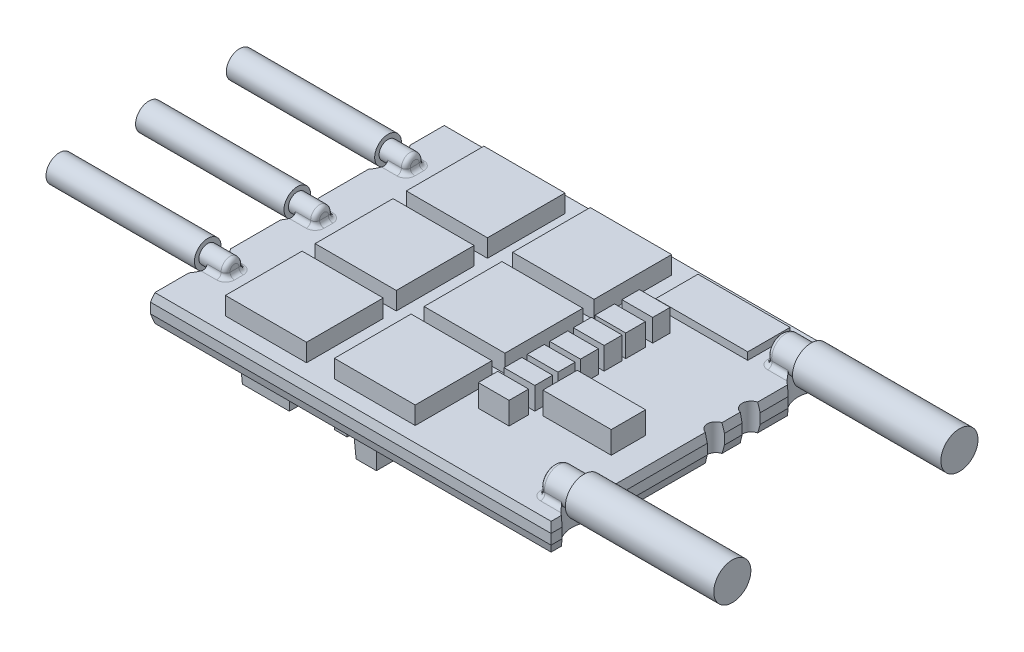
from build123d import *

# Parameters (mm, degrees)
ESQUISSE1_W                  = 27
ESQUISSE1_H                  = 19.8
BOSS_EXTRU_1_DEPTH           = 1.8
CHANFREIN1_SIZE              = 0.15
CHANFREIN1_SIZE2             = 0.559807621
CHANFREIN2_SIZE              = 0.15
CHANFREIN2_SIZE2             = 0.559807621
ESQUISSE2_R                  = 2.334528947
ESQUISSE2_R_2                = 2.262823971
ESQUISSE2_R_3                = 1.776828947
ESQUISSE2_R_4                = 0.577555873
ESQUISSE2_R_5                = 0.603985222
ENL_V_MAT_EXTRU_1_DEPTH      = 1.8
ESQUISSE3_W                  = 5.467187449
ESQUISSE3_H                  = 5.227748583
ESQUISSE3_H_2                = 5.247701822
ESQUISSE3_H_3                = 5.167888865
ESQUISSE3_W_2                = 5.487140688
ESQUISSE3_W_3                = 5.44723421
BOSS_EXTRU_2_DEPTH           = 1.2
ESQUISSE4_W                  = 2.075136842
ESQUISSE4_H                  = 1.177241093
ESQUISSE4_H_2                = 1.316913765
ESQUISSE4_H_3                = 1.21714757
ESQUISSE4_H_4                = 1.217147571
ESQUISSE4_H_5                = 1.157287854
ESQUISSE4_H_6                = 1.197194332
ESQUISSE4_W_2                = 4.609198178
ESQUISSE4_H_7                = 2.314575709
BOSS_EXTRU_3_DEPTH           = 1.5
ESQUISSE5_W                  = 6.205457286
ESQUISSE5_H                  = 2.853313158
BOSS_EXTRU_4_DEPTH           = 0.5
ESQUISSE7_W                  = 3.352144129
ESQUISSE7_H                  = 4.808730566
BOSS_EXTRU_5_DEPTH           = 1.8
BOSS_EXTRU_5_DRAFT           = 3
ESQUISSE7_H_2                = 5.008262955
BOSS_EXTRU_5_PROFILE_2_DEPTH = 1.8
BOSS_EXTRU_5_PROFILE_2_DRAFT = 3
ESQUISSE7_H_3                = 4.848637044
BOSS_EXTRU_5_PROFILE_3_DEPTH = 1.8
BOSS_EXTRU_5_PROFILE_3_DRAFT = 3
ESQUISSE7_W_2                = 6.644428542
ESQUISSE7_H_4                = 6.804054453
BOSS_EXTRU_5_PROFILE_4_DEPTH = 1.8
BOSS_EXTRU_5_PROFILE_4_DRAFT = 3
ESQUISSE7_W_3                = 1.556352632
ESQUISSE7_H_5                = 2.943102732
BOSS_EXTRU_5_PROFILE_5_DEPTH = 1.8
BOSS_EXTRU_5_PROFILE_5_DRAFT = 3
ESQUISSE7_W_4                = 0.857989271
ESQUISSE7_H_6                = 3.012939069
BOSS_EXTRU_5_PROFILE_6_DEPTH = 1.8
BOSS_EXTRU_5_PROFILE_6_DRAFT = 3
ESQUISSE7_W_5                = 1.037568421
ESQUISSE7_H_7                = 1.316913765
BOSS_EXTRU_5_PROFILE_7_DEPTH = 1.8
BOSS_EXTRU_5_PROFILE_7_DRAFT = 3
ESQUISSE8_R                  = 0.9
BOSS_EXTRU_6_DEPTH           = 10
BOSS_EXTRU_6_2_DEPTH         = 10
BOSS_EXTRU_6_3_DEPTH         = 10
ESQUISSE9_R                  = 0.6
BOSS_EXTRU_7_DEPTH           = 1.8
CONG_1_R                     = 0.3
ESQUISSE10_R                 = 1.25
BOSS_EXTRU_8_DEPTH           = 10
BOSS_EXTRU_8_2_DEPTH         = 10
ESQUISSE11_R                 = 0.95
BOSS_EXTRU_9_DEPTH           = 2
CONG_2_R                     = 0.3


with BuildPart() as part:
    # Esquisse1 → Boss.-Extru.1 (new body)
    with BuildSketch(Plane(origin=(0, 0, 0), x_dir=(1, 0, 0), z_dir=(0, 1, 0))):
        Rectangle(ESQUISSE1_W, ESQUISSE1_H)
    extrude(amount=BOSS_EXTRU_1_DEPTH)

    # Chanfrein1
    chanfrein1_edges = [part.edges().sort_by_distance(p)[0] for p in [
        (13.5, 1.8, 0),
        (0, 1.8, -9.9),
        (-13.5, 1.8, 0),
        (0, 1.8, 9.9),
    ]]
    chanfrein1_side = [part.faces().sort_by_distance(p)[0] for p in [
        (0, 1.8, 0),
    ]]
    chamfer(chanfrein1_edges, length=CHANFREIN1_SIZE, length2=CHANFREIN1_SIZE2, reference=chanfrein1_side[0])

    # Chanfrein2
    chanfrein2_edges = [part.edges().sort_by_distance(p)[0] for p in [
        (0, 0, -9.9),
        (13.5, 0, 0),
        (0, 0, 9.9),
        (-13.5, 0, 0),
    ]]
    chanfrein2_side = [part.faces().sort_by_distance(p)[0] for p in [
        (0, 0, 0),
    ]]
    chamfer(chanfrein2_edges, length=CHANFREIN2_SIZE, length2=CHANFREIN2_SIZE2, reference=chanfrein2_side[0])

    # Esquisse2 → Enlèv. mat.-Extru.1 (cut)
    with BuildSketch(Plane(origin=(0, 1.8, 0), x_dir=(1, 0, 0), z_dir=(0, 1, 0))):
        with Locations((-15.214344634, 6.045831376)):
            Circle(ESQUISSE2_R)
        with Locations((-15.220676016, 0)):
            Circle(ESQUISSE2_R_2)
        with Locations((-15.214344634, -6.045831376)):
            Circle(ESQUISSE2_R)
        with Locations((14.39092333, 7.616919158)):
            Circle(ESQUISSE2_R_3)
        with Locations((14.39092333, -7.616919158)):
            Circle(ESQUISSE2_R_3)
        with Locations((13.5, 1.202671446)):
            Circle(ESQUISSE2_R_4)
        with Locations((13.5, 3.581288306)):
            Circle(ESQUISSE2_R_5)
    extrude(amount=-ENL_V_MAT_EXTRU_1_DEPTH, mode=Mode.SUBTRACT)

    # Esquisse3 → Boss.-Extru.2 (add)
    with BuildSketch(Plane(origin=(0, 1.8, 0), x_dir=(1, 0, 0), z_dir=(0, 1, 0))):
        with Locations((-6.873890789, 6.065784615)):
            Rectangle(ESQUISSE3_W, ESQUISSE3_H)
        with Locations((-6.873890789, -0.069836336)):
            Rectangle(ESQUISSE3_W, ESQUISSE3_H_2)
        with Locations((-6.873890789, -6.15557419)):
            Rectangle(ESQUISSE3_W, ESQUISSE3_H_3)
        with Locations((0.299298583, 6.065784615)):
            Rectangle(ESQUISSE3_W_2, ESQUISSE3_H)
        with Locations((0.458924494, -0.069836336)):
            Rectangle(ESQUISSE3_W_3, ESQUISSE3_H_2)
        with Locations((0.458924494, -6.15557419)):
            Rectangle(ESQUISSE3_W_3, ESQUISSE3_H_3)
    extrude(amount=BOSS_EXTRU_2_DEPTH)

    # Esquisse4 → Boss.-Extru.3 (add)
    with BuildSketch(Plane(origin=(0, 1.8, 0), x_dir=(1, 0, 0), z_dir=(0, 1, 0))):
        with Locations((5.337491396, 4.659081275)):
            Rectangle(ESQUISSE4_W, ESQUISSE4_H)
        with Locations((5.337491396, 2.913172874)):
            Rectangle(ESQUISSE4_W, ESQUISSE4_H_2)
        with Locations((5.337491396, 1.40670334)):
            Rectangle(ESQUISSE4_W, ESQUISSE4_H_3)
        with Locations((5.337491396, -0.189555769)):
            Rectangle(ESQUISSE4_W, ESQUISSE4_H_4)
        with Locations((5.337491396, -1.735931781)):
            Rectangle(ESQUISSE4_W, ESQUISSE4_H_5)
        with Locations((5.337491396, -3.272331174)):
            Rectangle(ESQUISSE4_W, ESQUISSE4_H_6)
        with Locations((5.337491396, -4.948403239)):
            Rectangle(ESQUISSE4_W, ESQUISSE4_H_2)
        with Locations((9.218396355, -2.713640486)):
            Rectangle(ESQUISSE4_W_2, ESQUISSE4_H_7)
    extrude(amount=BOSS_EXTRU_3_DEPTH)

    # Esquisse5 → Boss.-Extru.4 (add)
    with BuildSketch(Plane(origin=(0, 1.8, 0), x_dir=(1, 0, 0), z_dir=(0, 1, 0))):
        with Locations((7.482464574, 7.691973582)):
            Rectangle(ESQUISSE5_W, ESQUISSE5_H)
    extrude(amount=BOSS_EXTRU_4_DEPTH)


with BuildPart() as boss_extru_5_tool:
    # Esquisse7 → Boss.-Extru.5 (with draft: the straight prism first)
    with BuildSketch(Plane.XZ):
        with Locations((-7.073423178, 6.235387145)):
            Rectangle(ESQUISSE7_W, ESQUISSE7_H)
    extrude(amount=BOSS_EXTRU_5_DEPTH)
    # Boss.-Extru.5: the draft: its side faces are tilted about the plane it starts from
    boss_extru_5_sides = [boss_extru_5_tool.faces().sort_by_distance(p)[0] for p in [
        (-8.749495242, -0.9, 6.235387145),
        (-7.073423177, -0.9, 3.831021862),
        (-5.397351113, -0.9, 6.235387145),
        (-7.073423177, -0.9, 8.639752428),
    ]]
    draft(boss_extru_5_sides, Plane.XZ, BOSS_EXTRU_5_DRAFT)


with BuildPart() as part_1:
    add(part.part)

    # Boss.-Extru.5: add boss_extru_5_tool
    add(boss_extru_5_tool.part)


with BuildPart() as boss_extru_5_profile_2_tool:
    # Esquisse7 → Boss.-Extru.5 profile 2 (with draft: the straight prism first)
    with BuildSketch(Plane.XZ):
        with Locations((-7.073423178, 0.109742814)):
            Rectangle(ESQUISSE7_W, ESQUISSE7_H_2)
    extrude(amount=BOSS_EXTRU_5_PROFILE_2_DEPTH)
    # Boss.-Extru.5 profile 2: the draft: its side faces are tilted about the plane it starts from
    boss_extru_5_profile_2_sides = [boss_extru_5_profile_2_tool.faces().sort_by_distance(p)[0] for p in [
        (-8.749495242, -0.9, 0.109742814),
        (-7.073423177, -0.9, -2.394388664),
        (-5.397351113, -0.9, 0.109742814),
        (-7.073423177, -0.9, 2.613874291),
    ]]
    draft(boss_extru_5_profile_2_sides, Plane.XZ, BOSS_EXTRU_5_PROFILE_2_DRAFT)


with BuildPart() as part_2:
    add(part_1.part)

    # Boss.-Extru.5 profile 2: add boss_extru_5_profile_2_tool
    add(boss_extru_5_profile_2_tool.part)


with BuildPart() as boss_extru_5_profile_3_tool:
    # Esquisse7 → Boss.-Extru.5 profile 3 (with draft: the straight prism first)
    with BuildSketch(Plane.XZ):
        with Locations((-7.073423178, -6.035854756)):
            Rectangle(ESQUISSE7_W, ESQUISSE7_H_3)
    extrude(amount=BOSS_EXTRU_5_PROFILE_3_DEPTH)
    # Boss.-Extru.5 profile 3: the draft: its side faces are tilted about the plane it starts from
    boss_extru_5_profile_3_sides = [boss_extru_5_profile_3_tool.faces().sort_by_distance(p)[0] for p in [
        (-8.749495242, -0.9, -6.035854756),
        (-7.073423177, -0.9, -8.460173278),
        (-5.397351113, -0.9, -6.035854756),
        (-7.073423177, -0.9, -3.611536234),
    ]]
    draft(boss_extru_5_profile_3_sides, Plane.XZ, BOSS_EXTRU_5_PROFILE_3_DRAFT)


with BuildPart() as part_3:
    add(part_2.part)

    # Boss.-Extru.5 profile 3: add boss_extru_5_profile_3_tool
    add(boss_extru_5_profile_3_tool.part)


with BuildPart() as boss_extru_5_profile_4_tool:
    # Esquisse7 → Boss.-Extru.5 profile 4 (with draft: the straight prism first)
    with BuildSketch(Plane.XZ):
        with Locations((4.110367206, 0.149649292)):
            Rectangle(ESQUISSE7_W_2, ESQUISSE7_H_4)
    extrude(amount=BOSS_EXTRU_5_PROFILE_4_DEPTH)
    # Boss.-Extru.5 profile 4: the draft: its side faces are tilted about the plane it starts from
    boss_extru_5_profile_4_sides = [boss_extru_5_profile_4_tool.faces().sort_by_distance(p)[0] for p in [
        (0.788152935, -0.9, 0.149649291),
        (4.110367206, -0.9, -3.252377935),
        (7.432581477, -0.9, 0.149649291),
        (4.110367206, -0.9, 3.551676518),
    ]]
    draft(boss_extru_5_profile_4_sides, Plane.XZ, BOSS_EXTRU_5_PROFILE_4_DRAFT)


with BuildPart() as part_4:
    add(part_3.part)

    # Boss.-Extru.5 profile 4: add boss_extru_5_profile_4_tool
    add(boss_extru_5_profile_4_tool.part)


with BuildPart() as boss_extru_5_profile_5_tool:
    # Esquisse7 → Boss.-Extru.5 profile 5 (with draft: the straight prism first)
    with BuildSketch(Plane.XZ):
        with Locations((0.229462247, 7.706938511)):
            Rectangle(ESQUISSE7_W_3, ESQUISSE7_H_5)
    extrude(amount=BOSS_EXTRU_5_PROFILE_5_DEPTH)
    # Boss.-Extru.5 profile 5: the draft: its side faces are tilted about the plane it starts from
    boss_extru_5_profile_5_sides = [boss_extru_5_profile_5_tool.faces().sort_by_distance(p)[0] for p in [
        (-0.548714069, -0.9, 7.706938511),
        (0.229462247, -0.9, 6.235387145),
        (1.007638563, -0.9, 7.706938511),
        (0.229462247, -0.9, 9.178489877),
    ]]
    draft(boss_extru_5_profile_5_sides, Plane.XZ, BOSS_EXTRU_5_PROFILE_5_DRAFT)


with BuildPart() as part_5:
    add(part_4.part)

    # Boss.-Extru.5 profile 5: add boss_extru_5_profile_5_tool
    add(boss_extru_5_profile_5_tool.part)


with BuildPart() as boss_extru_5_profile_6_tool:
    # Esquisse7 → Boss.-Extru.5 profile 6 (with draft: the straight prism first)
    with BuildSketch(Plane.XZ):
        with Locations((11.05409433, -0.887919129)):
            Rectangle(ESQUISSE7_W_4, ESQUISSE7_H_6)
    extrude(amount=BOSS_EXTRU_5_PROFILE_6_DEPTH)
    # Boss.-Extru.5 profile 6: the draft: its side faces are tilted about the plane it starts from
    boss_extru_5_profile_6_sides = [boss_extru_5_profile_6_tool.faces().sort_by_distance(p)[0] for p in [
        (10.625099695, -0.9, -0.887919129),
        (11.054094331, -0.9, -2.394388664),
        (11.483088966, -0.9, -0.887919129),
        (11.054094331, -0.9, 0.618550405),
    ]]
    draft(boss_extru_5_profile_6_sides, Plane.XZ, BOSS_EXTRU_5_PROFILE_6_DRAFT)


with BuildPart() as part_6:
    add(part_5.part)

    # Boss.-Extru.5 profile 6: add boss_extru_5_profile_6_tool
    add(boss_extru_5_profile_6_tool.part)


with BuildPart() as boss_extru_5_profile_7_tool:
    # Esquisse7 → Boss.-Extru.5 profile 7 (with draft: the straight prism first)
    with BuildSketch(Plane.XZ):
        with Locations((-2.464224999, 7.542324291)):
            Rectangle(ESQUISSE7_W_5, ESQUISSE7_H_7)
    extrude(amount=BOSS_EXTRU_5_PROFILE_7_DEPTH)
    # Boss.-Extru.5 profile 7: the draft: its side faces are tilted about the plane it starts from
    boss_extru_5_profile_7_sides = [boss_extru_5_profile_7_tool.faces().sort_by_distance(p)[0] for p in [
        (-2.464225, -0.9, 8.200781173),
        (-2.98300921, -0.9, 7.542324291),
        (-2.464225, -0.9, 6.883867408),
        (-1.945440789, -0.9, 7.542324291),
    ]]
    draft(boss_extru_5_profile_7_sides, Plane.XZ, BOSS_EXTRU_5_PROFILE_7_DRAFT)


with BuildPart() as part_7:
    add(part_6.part)

    # Boss.-Extru.5 profile 7: add boss_extru_5_profile_7_tool
    add(boss_extru_5_profile_7_tool.part)



with BuildPart() as body_2:
    # Esquisse8 → Boss.-Extru.6 (new body)
    with BuildSketch(Plane.ZY.offset(13.5)):
        with Locations((-6.110987576, 2.129455097)):
            Circle(ESQUISSE8_R)
    extrude(amount=BOSS_EXTRU_6_DEPTH)


with BuildPart() as body_3:
    # Esquisse8 → Boss.-Extru.6 2 (new body)
    with BuildSketch(Plane.ZY.offset(13.5)):
        with Locations((0, 2.129455097)):
            Circle(ESQUISSE8_R)
    extrude(amount=BOSS_EXTRU_6_2_DEPTH)


with BuildPart() as body_4:
    # Esquisse8 → Boss.-Extru.6 3 (new body)
    with BuildSketch(Plane.ZY.offset(13.5)):
        with Locations((6.035705543, 2.129455097)):
            Circle(ESQUISSE8_R)
    extrude(amount=BOSS_EXTRU_6_3_DEPTH)


with BuildPart() as part_8:
    add(part_7.part)

    add(body_2.part)  # Boss.-Extru.7 merges body 2

    add(body_3.part)  # Boss.-Extru.7 merges body 3

    add(body_4.part)  # Boss.-Extru.7 merges body 4
    # Esquisse9 → Boss.-Extru.7 (add)
    with BuildSketch(Plane(origin=(-13.5, 0, 0), x_dir=(0, 0, -1), z_dir=(1, 0, 0))):
        with Locations(Location((-6.035705543, 2.129455097, 0), (0, 0, 180))):
            Circle(ESQUISSE9_R)
        with Locations(Location((0, 2.129455097, 0), (0, 0, 180))):
            Circle(ESQUISSE9_R)
        with Locations(Location((6.110987576, 2.129455097, 0), (0, 0, 180))):
            Circle(ESQUISSE9_R)
    extrude(amount=BOSS_EXTRU_7_DEPTH)

    # Congé1
    cong_1_edges = [part_8.edges().sort_by_distance(p)[0] for p in [
        (-11.7, 1.8, 6.035705543),
        (-12.318279413, 1.8, 5.534248327),
        (-12.316052376, 1.8, 6.537162758),
        (-11.7, 2.704291739, 5.863767079),
        (-11.7, 1.8, 0),
        (-12.357057334, 1.8, -0.501457215),
        (-12.357057334, 1.8, 0.501457215),
        (-11.7, 2.704291739, -0.171938464),
        (-11.7, 1.8, -6.110987576),
        (-12.324810334, 1.8, -6.612444792),
        (-12.310474141, 1.8, -5.609530361),
        (-11.7, 2.704291739, -6.28292604),
    ]]
    fillet(cong_1_edges, radius=CONG_1_R)



with BuildPart() as body_2_2:
    # Esquisse10 → Boss.-Extru.8 (new body)
    with BuildSketch(Plane(origin=(13.5, 0, 0), x_dir=(0, 0, -1), z_dir=(1, 0, 0))):
        with Locations((-7.68931315, 2.344928893)):
            Circle(ESQUISSE10_R)
    extrude(amount=BOSS_EXTRU_8_DEPTH)


with BuildPart() as body_3_2:
    # Esquisse10 → Boss.-Extru.8 2 (new body)
    with BuildSketch(Plane(origin=(13.5, 0, 0), x_dir=(0, 0, -1), z_dir=(1, 0, 0))):
        with Locations((7.616151274, 2.344928893)):
            Circle(ESQUISSE10_R)
    extrude(amount=BOSS_EXTRU_8_2_DEPTH)


with BuildPart() as part_9:
    add(part_8.part)

    add(body_2_2.part)  # Boss.-Extru.9 merges body 2 2

    add(body_3_2.part)  # Boss.-Extru.9 merges body 3 2
    # Esquisse11 → Boss.-Extru.9 (add)
    with BuildSketch(Plane.ZY.offset(-13.5)):
        with Locations(Location((7.68931315, 2.344928893, 0), (0, 0, 180))):
            Circle(ESQUISSE11_R)
        with Locations(Location((-7.616151274, 2.344928893, 0), (0, 0, 180))):
            Circle(ESQUISSE11_R)
    extrude(amount=BOSS_EXTRU_9_DEPTH)

    # Congé2
    cong_2_edges = [part_9.edges().sort_by_distance(p)[0] for p in [
        (11.5, 1.8, 7.68931315),
        (12.165452421, 1.8, 8.46748569),
        (12.130139988, 1.8, 6.911140611),
        (11.5, 3.250954255, 7.975001868),
        (11.5, 1.8, -7.616151274),
        (12.146967313, 1.8, -6.837978735),
        (12.14659323, 1.8, -8.394323814),
        (11.5, 3.250954255, -7.330462556),
    ]]
    fillet(cong_2_edges, radius=CONG_2_R)


solid = part_9.part
